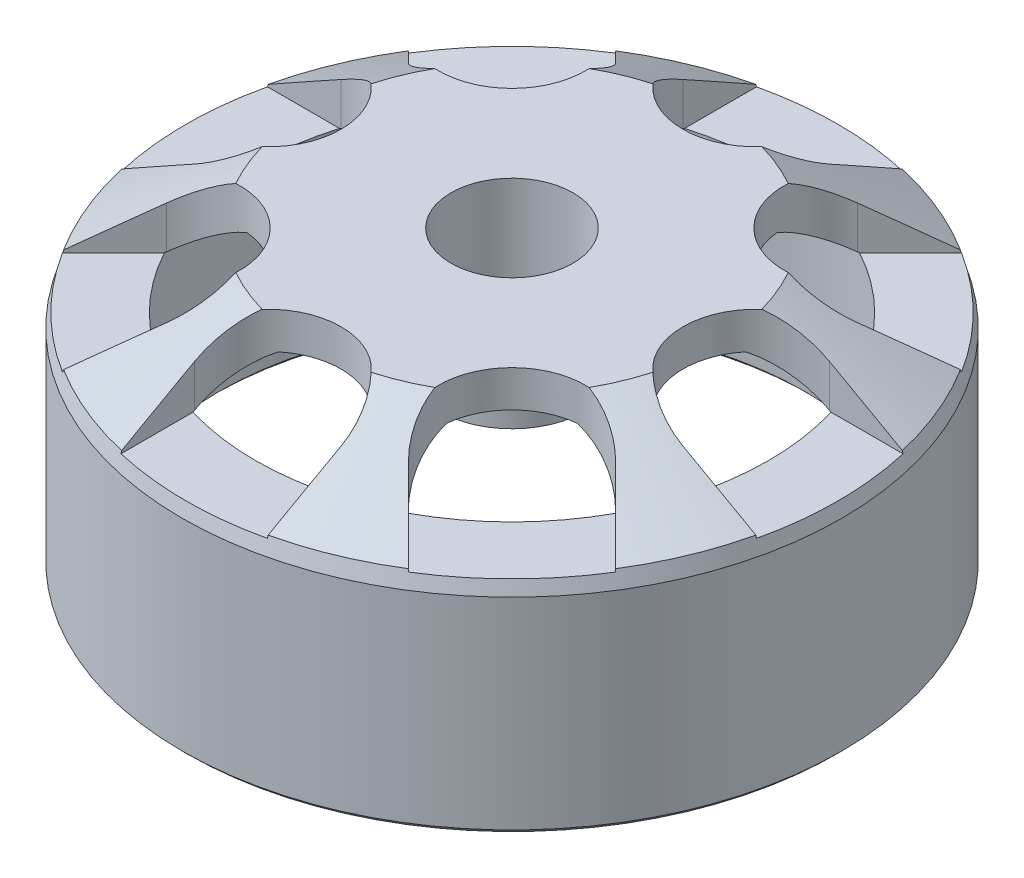
from build123d import *
from OCP.BRepFilletAPI import BRepFilletAPI_MakeChamfer

# Parameters (mm, degrees)
CHAMFER1_SIZE      = 0.2
CHAMFER1_SIZE2     = 0.546410162
CUT_EXTRUDE1_DEPTH = 3
CIRPATTERN1_COUNT  = 8


with BuildPart() as part:
    # Sketch1 → Revolve1 (revolve)
    with BuildSketch(Plane.XY, mode=Mode.PRIVATE) as revolve1_sk:
        Polygon((-2.5, 7.5), (-2.5, 12.5), (-8.303847577, 12.5), (-13.5, 9.5), (-13.5, 0.5), (-12, 0.5), (-12, 8.633974596), (-7.901923789, 11), (-3, 11), (-3, 7.5), align=None)
    revolve(revolve1_sk.sketch.rotate(Axis((0, 0, 0), (0, 1, 0)), 270), axis=Axis((0, 0, 0), (0, 1, 0)))

    # Chamfer1: one chamfer whose edges measure the first distance from different faces: ONE call of the kernel's chamfer builder (chamfer() names one face for all edges)
    chamfer1_edges_1 = [part.edges().sort_by_distance(p)[0] for p in [
        (0, 0.5, 13.5),
        (0, 0.5, 12),
    ]]
    chamfer1_edges_2 = [part.edges().sort_by_distance(p)[0] for p in [
        (0, 9.5, 13.5),
    ]]
    chamfer1_side_2 = [part.faces().sort_by_distance(p)[0] for p in [
        (0, 11, 10.901923789),
    ]]
    chamfer1 = BRepFilletAPI_MakeChamfer(part.part.solid().wrapped)
    for e in chamfer1_edges_1:
        chamfer1.Add(CHAMFER1_SIZE, e.wrapped)
    for e in chamfer1_edges_2:
        chamfer1.Add(CHAMFER1_SIZE, CHAMFER1_SIZE2, e.wrapped, chamfer1_side_2[0].wrapped)  # the first distance lies on this face
    add(Compound.cast(chamfer1.Shape()), mode=Mode.REPLACE)

    # Sketch2 → Cut-Extrude1 (cut)
    with BuildSketch(Plane(origin=(0, 12.5, 0), x_dir=(1, 0, 0), z_dir=(0, 1, 0))):
        with BuildLine():
            Line((3, -10), (3, -15))
            Line((3, -15), (-3, -15))
            Line((-3, -15), (-3, -10))
            ThreePointArc((-3, -10), (0, -7), (3, -10))
        make_face()
    cut_extrude1 = extrude(amount=-CUT_EXTRUDE1_DEPTH, mode=Mode.SUBTRACT)

    # CirPattern1: Cut-Extrude1 ×8 about axis
    cirpattern1_axis = Axis((0, 0, 0), (0, 1, 0))
    for i in range(1, CIRPATTERN1_COUNT):
        add(cut_extrude1.rotate(cirpattern1_axis, i * 360 / CIRPATTERN1_COUNT), mode=Mode.SUBTRACT)


solid = part.part
